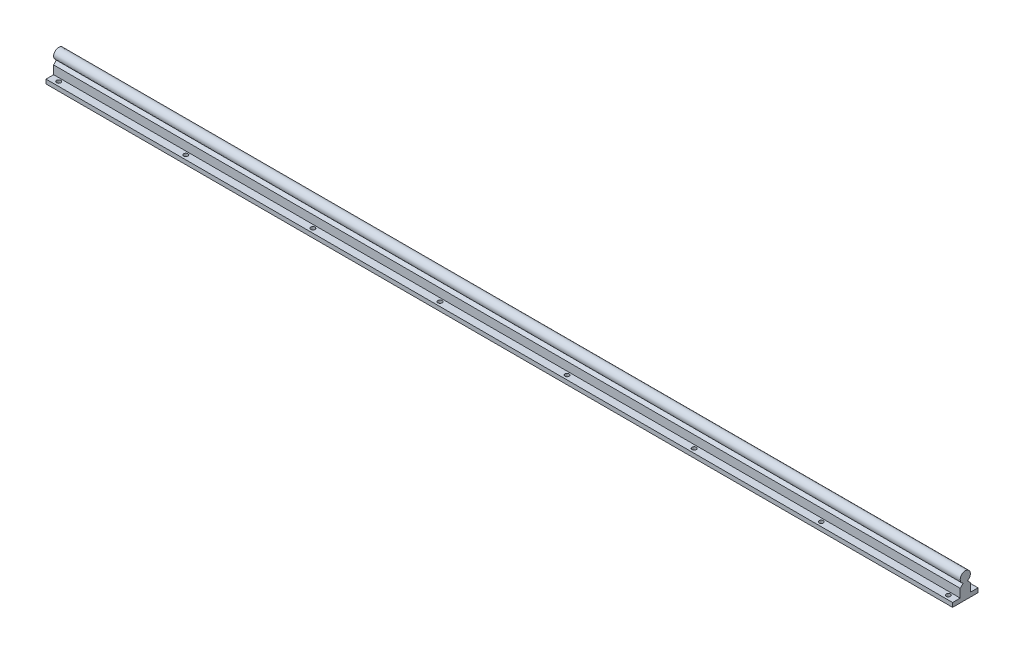
from build123d import *

# Parameters (mm, degrees)
EXTRUDE_1_DEPTH        = 535
SKETCH_2_R             = 2.5
CUT_EXTRUDE_1_DEPTH    = 1070
PATTERN_LINEAR_1_COUNT = 8
PATTERN_LINEAR_1_PITCH = 150


with BuildPart() as part:
    # Эскиз1 → Бобышка-Вытянуть1 (new, symmetric)
    with BuildSketch(Plane(origin=(0, 0, 0), x_dir=(0, 0, -1), z_dir=(1, 0, 0))):
        with BuildLine():
            Line((-6, 15), (-2.5, 18.545643943))
            ThreePointArc((-2.5, 18.545643943), (0, 30), (2.5, 18.545643943))
            Line((2.5, 18.545643943), (6, 15))
            Line((6, 15), (6, 5))
            Line((6, 5), (15, 5))
            Line((15, 5), (15, 0))
            Line((15, 0), (-15, 0))
            Line((-15, 0), (-15, 5))
            Line((-15, 5), (-6, 5))
            Line((-6, 5), (-6, 15))
        make_face()
    extrude(amount=EXTRUDE_1_DEPTH, both=True)

    # Эскиз2 → Вырез-Вытянуть1 (cut)
    with BuildSketch(Plane.XZ):
        with Locations(Location((-525, 10, 0), (0, 0, 270))):
            Circle(SKETCH_2_R)
        with Locations(Location((-525, -10, 0), (0, 0, 270))):
            Circle(SKETCH_2_R)
    cut_extrude_1 = extrude(amount=-CUT_EXTRUDE_1_DEPTH, mode=Mode.SUBTRACT)

    # Линейный массив1: Вырез-Вытянуть1 ×8
    with Locations(*[(i * PATTERN_LINEAR_1_PITCH, 0, 0) for i in range(1, PATTERN_LINEAR_1_COUNT)]):
        add(cut_extrude_1, mode=Mode.SUBTRACT)


solid = part.part
